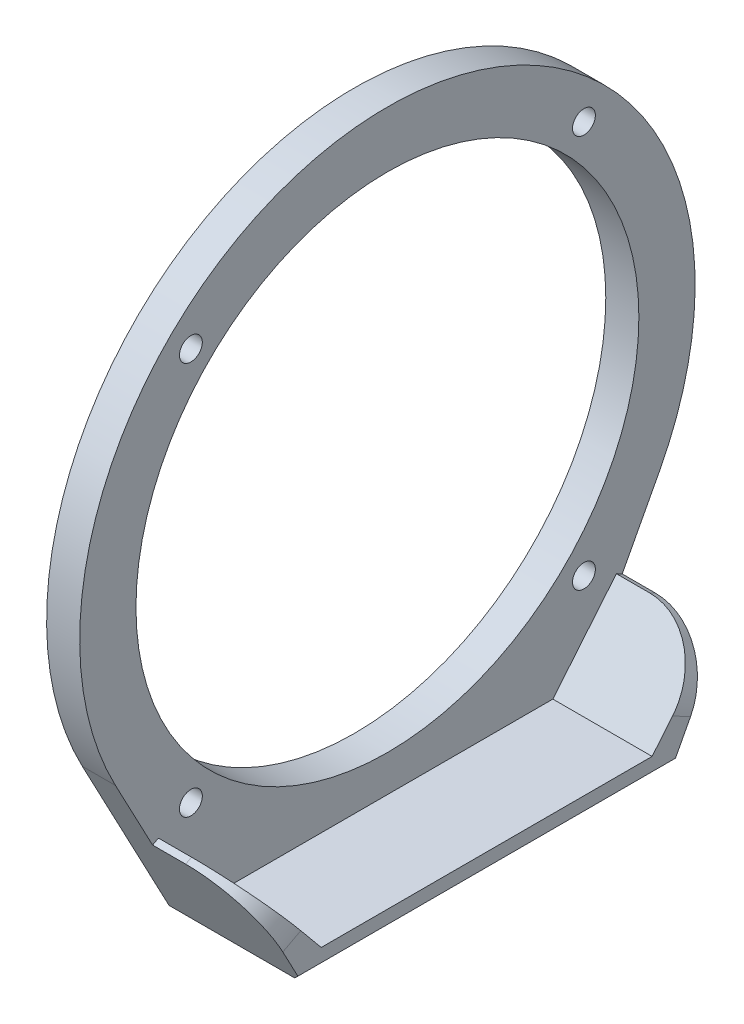
from build123d import *

# Parameters (mm, degrees)
SKETCH1_R             = 38
BOSS_EXTRUDE1_DEPTH   = 5
BOSS_EXTRUDE2_DEPTH   = 15
F_4_CLEARANCE_HOLE1_D = 3.4544
FILLET1_R             = 10
CHAMFER1_SIZE         = 1


with BuildPart() as part:
    # Sketch1 → Boss-Extrude1 (new body)
    with BuildSketch(Plane(origin=(0, 0, 0), x_dir=(0, 0, -1), z_dir=(1, 0, 0))):
        with BuildLine():
            Line((-28, -46.5), (28, -46.5))
            Line((28, -46.5), (41.098345354, -21.752609249))
            ThreePointArc((41.098345354, -21.752609249), (0, 46.5), (-41.098345354, -21.752609249))
            Line((-41.098345354, -21.752609249), (-28, -46.5))
        make_face()
        Circle(SKETCH1_R, mode=Mode.SUBTRACT)
    extrude(amount=BOSS_EXTRUDE1_DEPTH)

    # Sketch2 → Boss-Extrude2 (add)
    with BuildSketch(Plane(origin=(5, 0, 0), x_dir=(0, 0, -1), z_dir=(1, 0, 0))):
        Polygon((-28, -46.5), (28, -46.5), (35.484768774, -32.358633857), (34.60093339, -31.890835808), (25, -43.5), (-25, -43.5), (-34.60093339, -31.890835808), (-35.484768774, -32.358633857), align=None)
    extrude(amount=BOSS_EXTRUDE2_DEPTH)

    # #4 Clearance Hole1 (through all)
    with Locations(Plane.ZY):
        with Locations((-29.69848481, -29.69848481), (-29.69848481, 29.69848481), (29.69848481, 29.69848481), (29.69848481, -29.69848481)):
            Hole(F_4_CLEARANCE_HOLE1_D / 2)

    # Fillet1
    fillet1_edges = [part.edges().sort_by_distance(p)[0] for p in [
        (20, -32.124734832, -35.042851082),
        (20, -32.124734832, 35.042851082),
    ]]
    fillet(fillet1_edges, radius=FILLET1_R)

    # Chamfer1
    chamfer1_edges = [part.edges().sort_by_distance(p)[0] for p in [
        (20, -46.5, 0),
    ]]
    chamfer(chamfer1_edges, length=CHAMFER1_SIZE)


solid = part.part
